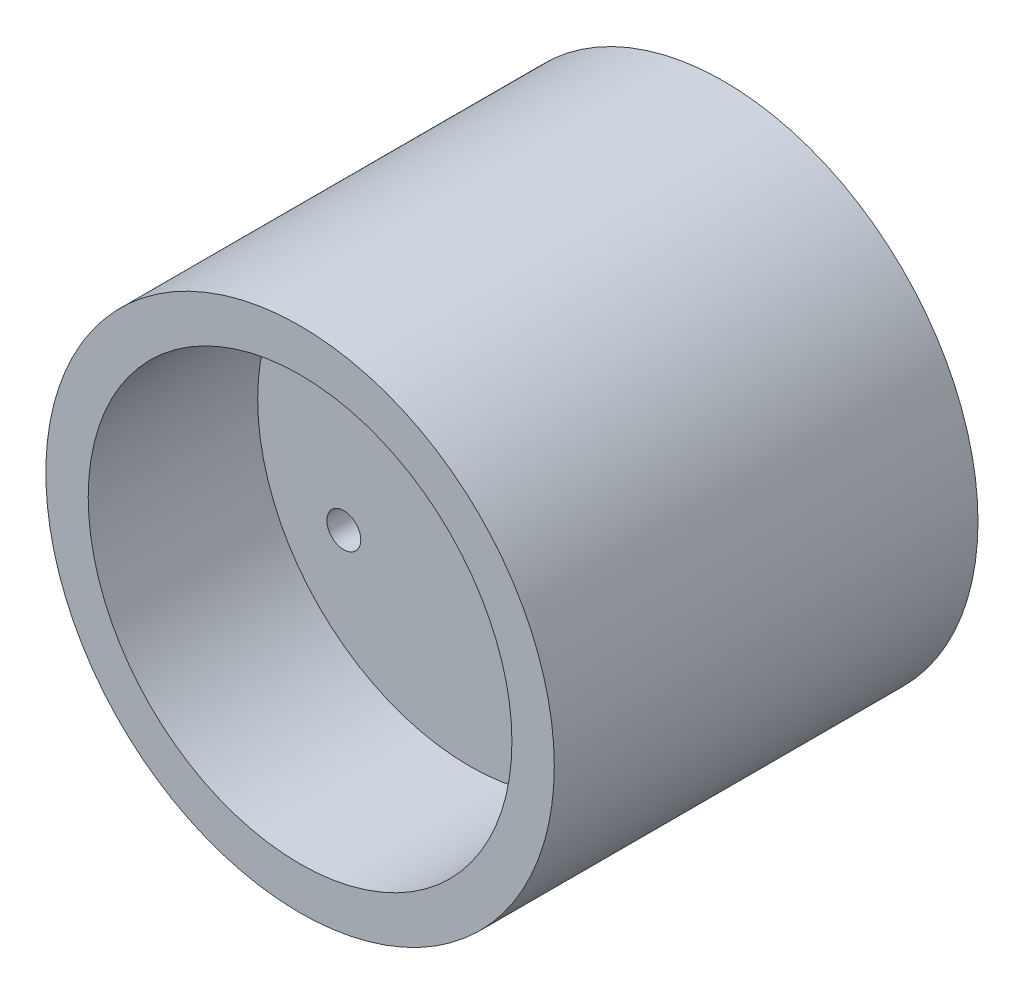
from build123d import *

# Parameters (mm, degrees)
IZIM1_R                     = 30
Y_KSEKLIK_EKSTR_ZYON1_DEPTH = 50
SCALE1_SCALE                = 0.5
SKETCH2_R                   = 12.5
CUT_EXTRUDE1_DEPTH          = 5
CUT_EXTRUDE2_START          = -10
SKETCH3_R                   = 12.5
CUT_EXTRUDE2_DEPTH          = 10
SKETCH4_R                   = 1
CUT_EXTRUDE3_DEPTH          = 10


with BuildPart() as part:
    # Çizim1 → Yükseklik-Ekstrüzyon1 (new body)
    with BuildSketch(Plane.XY):
        with Locations((-8.148787303, -1.554097453)):
            Circle(IZIM1_R)
    extrude(amount=Y_KSEKLIK_EKSTR_ZYON1_DEPTH)


with BuildPart() as part_1:
    # Scale1: scaled about (-8.148787303, -1.554097453, 25)
    add(part.part.scale(SCALE1_SCALE).moved(Location((-4.074393652, -0.777048727, 12.5))))

    # Sketch2 → Cut-Extrude1 (cut)
    with BuildSketch(Plane(origin=(0, 0, 12.5), x_dir=(-1, 0, 0), z_dir=(0, 0, -1))):
        with Locations((8.148787303, -1.554097453)):
            Circle(SKETCH2_R)
    extrude(amount=-CUT_EXTRUDE1_DEPTH, mode=Mode.SUBTRACT)

    # Sketch3 → Cut-Extrude2 (cut)
    with BuildSketch(Plane.XY.offset(37.5).offset(CUT_EXTRUDE2_START)):
        with Locations(Location((-8.148787303, -1.554097453, 0), (0, 0, 180))):
            Circle(SKETCH3_R)
    extrude(amount=CUT_EXTRUDE2_DEPTH, mode=Mode.SUBTRACT)

    # Sketch4 → Cut-Extrude3 (cut)
    with BuildSketch(Plane(origin=(0, 0, 17.5), x_dir=(-1, 0, 0), z_dir=(0, 0, -1))):
        with Locations((15.566518124, -5.706210793)):
            Circle(SKETCH4_R)
        with Locations((0.84408626, -5.901984113)):
            Circle(SKETCH4_R)
        with Locations((8.035757524, 6.945902547)):
            Circle(SKETCH4_R)
    extrude(amount=-CUT_EXTRUDE3_DEPTH, mode=Mode.SUBTRACT)


solid = part_1.part
